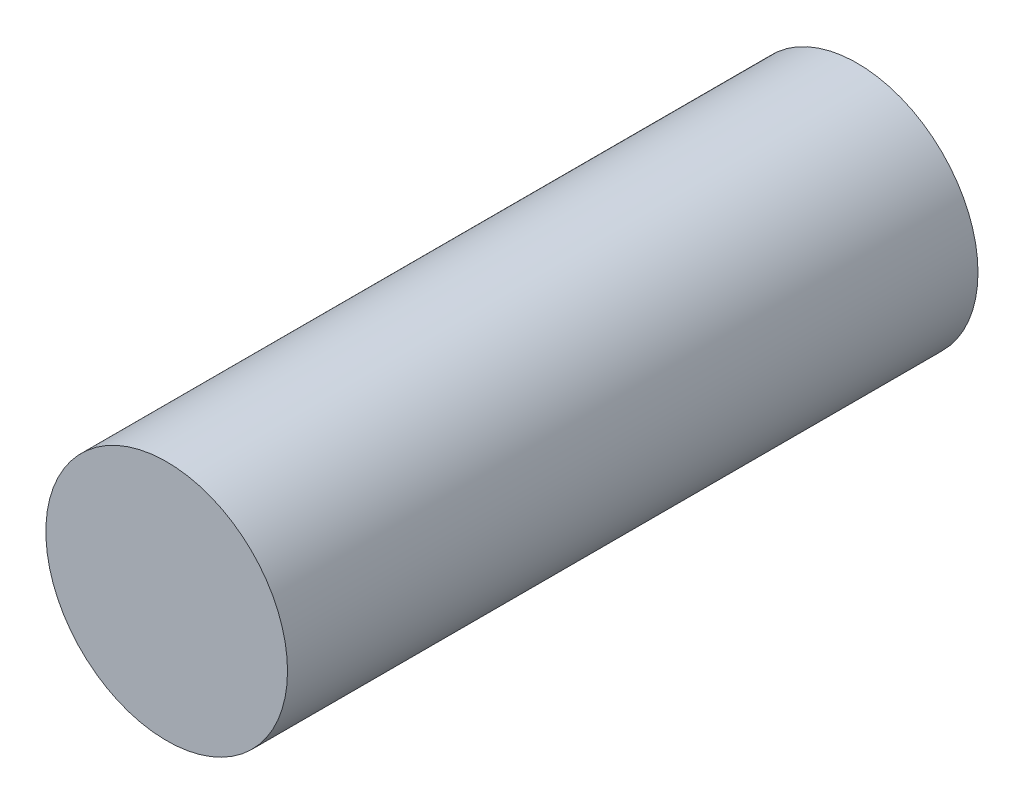
from build123d import *

# Parameters (mm, degrees)
SKETCH1_R           = 3.5
BOSS_EXTRUDE1_DEPTH = 20
CUT_EXTRUDE1_DEPTH  = 10


with BuildPart() as part:
    # Sketch1 → Boss-Extrude1 (new body)
    with BuildSketch(Plane.XY):
        Circle(SKETCH1_R)
    extrude(amount=BOSS_EXTRUDE1_DEPTH)

    # Sketch2 → Cut-Extrude1 (cut)
    with BuildSketch(Plane(origin=(0, 0, 0), x_dir=(-1, 0, 0), z_dir=(0, 0, -1))):
        with BuildLine():
            Line((-1.398248905, 1.43), (1.398248905, 1.43))
            ThreePointArc((1.398248905, 1.43), (0, -2), (-1.398248905, 1.43))
        make_face()
    extrude(amount=-CUT_EXTRUDE1_DEPTH, mode=Mode.SUBTRACT)


solid = part.part
